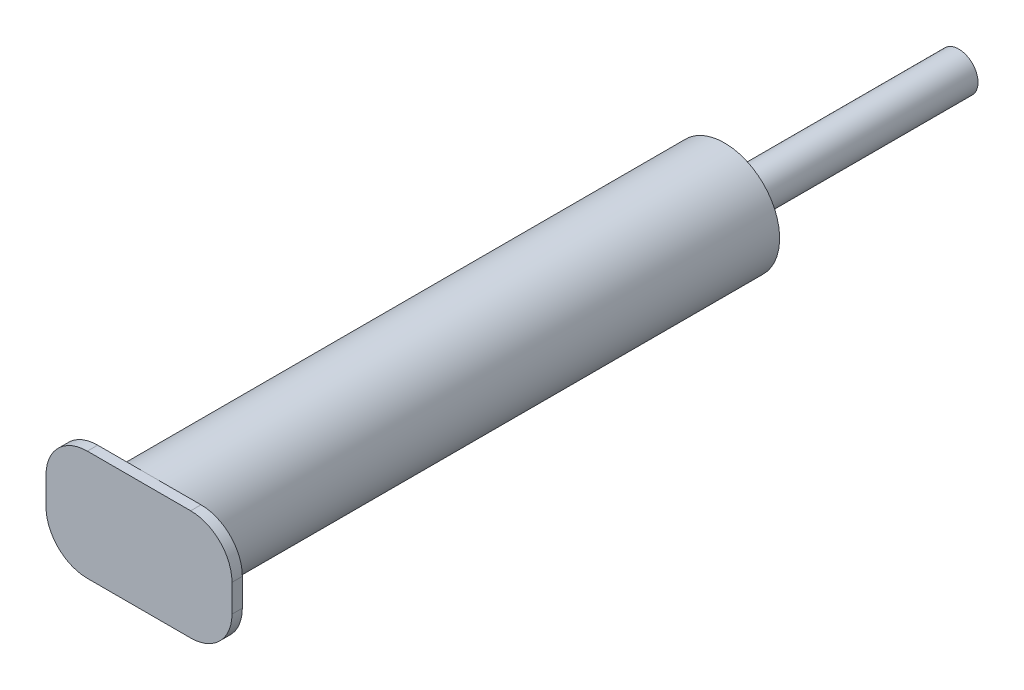
from build123d import *

# Parameters (mm, degrees)
SKETCH1_R           = 8
BOSS_EXTRUDE1_DEPTH = 85
SKETCH2_R           = 8
BOSS_EXTRUDE3_DEPTH = 3
BOSS_EXTRUDE3_TAPER = 60
SKETCH3_R           = 2.803847577
BOSS_EXTRUDE4_DEPTH = 31
BOSS_EXTRUDE5_DEPTH = 1.5


with BuildPart() as part:
    # Sketch1 → Boss-Extrude1 (new body)
    with BuildSketch(Plane(origin=(0, 0, 0), x_dir=(0, 1, 0), z_dir=(0, 0, 1))):
        with Locations(Location((0, 0, 0), (0, 0, 270))):
            Circle(SKETCH1_R)
    extrude(amount=BOSS_EXTRUDE1_DEPTH)

    # Sketch2 → Boss-Extrude3 (add)
    with BuildSketch(Plane(origin=(0, 0, 0), x_dir=(1, 0, 0), z_dir=(0, 0, -1))):
        with Locations(Location((0, 0, 0), (0, 0, 180))):
            Circle(SKETCH2_R)
    extrude(amount=BOSS_EXTRUDE3_DEPTH, taper=BOSS_EXTRUDE3_TAPER)

    # Sketch3 → Boss-Extrude4 (add)
    with BuildSketch(Plane(origin=(0, 0, -3), x_dir=(1, 0, 0), z_dir=(0, 0, -1))):
        with Locations(Location((0, 0, 0), (0, 0, 180))):
            Circle(SKETCH3_R)
    extrude(amount=BOSS_EXTRUDE4_DEPTH)

    # Sketch4 → Boss-Extrude5 (add)
    with BuildSketch(Plane.XY.offset(85)):
        with BuildLine():
            Line((-7.5, 8), (7.5, 8))
            ThreePointArc((7.5, 8), (11.742640687, 6.242640687), (13.5, 2))
            Line((13.5, 2), (13.5, -2))
            ThreePointArc((13.5, -2), (11.742640687, -6.242640687), (7.5, -8))
            Line((7.5, -8), (-7.5, -8))
            ThreePointArc((-7.5, -8), (-11.742640687, -6.242640687), (-13.5, -2))
            Line((-13.5, -2), (-13.5, 2))
            ThreePointArc((-13.5, 2), (-11.742640687, 6.242640687), (-7.5, 8))
        make_face()
    extrude(amount=-BOSS_EXTRUDE5_DEPTH)


solid = part.part
